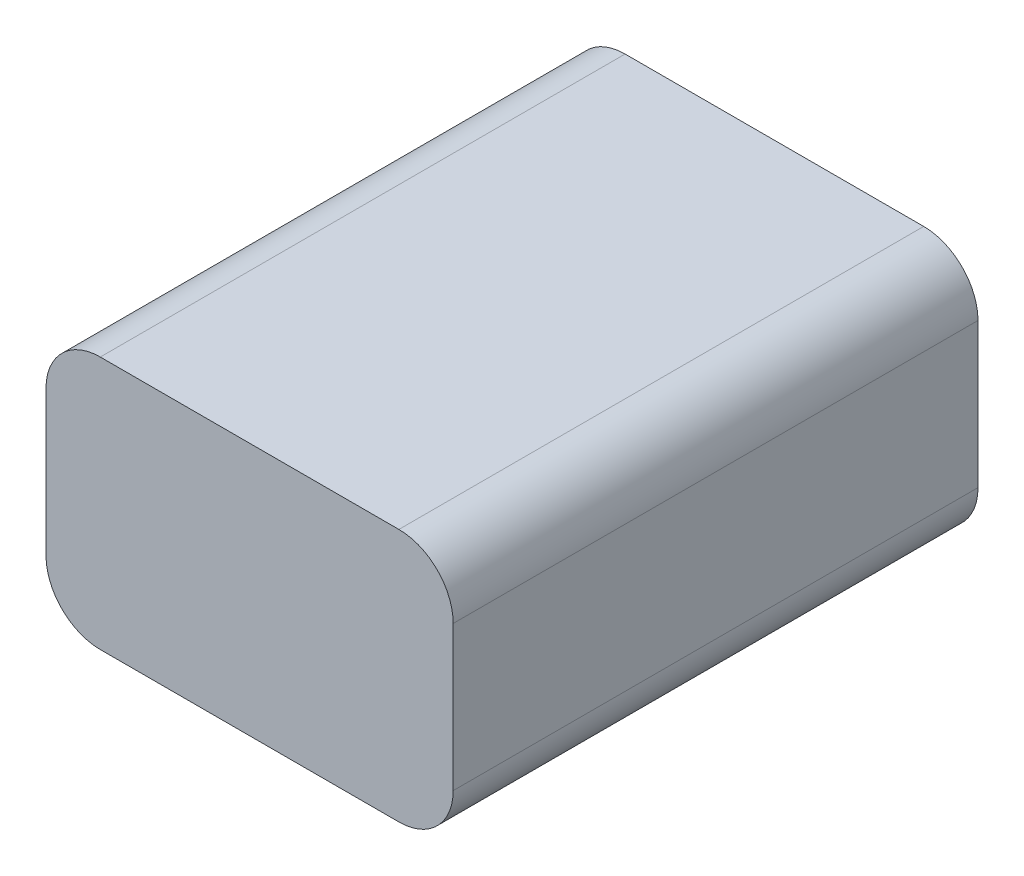
from build123d import *

# Parameters (mm, degrees)
BOSS_EXTRUDE1_DEPTH      = 29
BOSS_EXTRUDE1_DEPTH_BACK = 29
SKETCH1_W                = 45
SKETCH1_H                = 28
FILLET1_R                = 6


with BuildPart() as part:
    # Sketch1 → Boss-Extrude1 (new, two sides: drawn at the far end of the back side and taken through both)
    with BuildSketch(Plane.XY.offset(-BOSS_EXTRUDE1_DEPTH_BACK)):
        Rectangle(SKETCH1_W, SKETCH1_H)
    extrude(amount=BOSS_EXTRUDE1_DEPTH + BOSS_EXTRUDE1_DEPTH_BACK)

    # Fillet1
    fillet1_edges = [part.edges().sort_by_distance(p)[0] for p in [
        (-22.5, -14, 0),
        (22.5, -14, 0),
        (22.5, 14, 0),
        (-22.5, 14, 0),
    ]]
    fillet(fillet1_edges, radius=FILLET1_R)


solid = part.part
